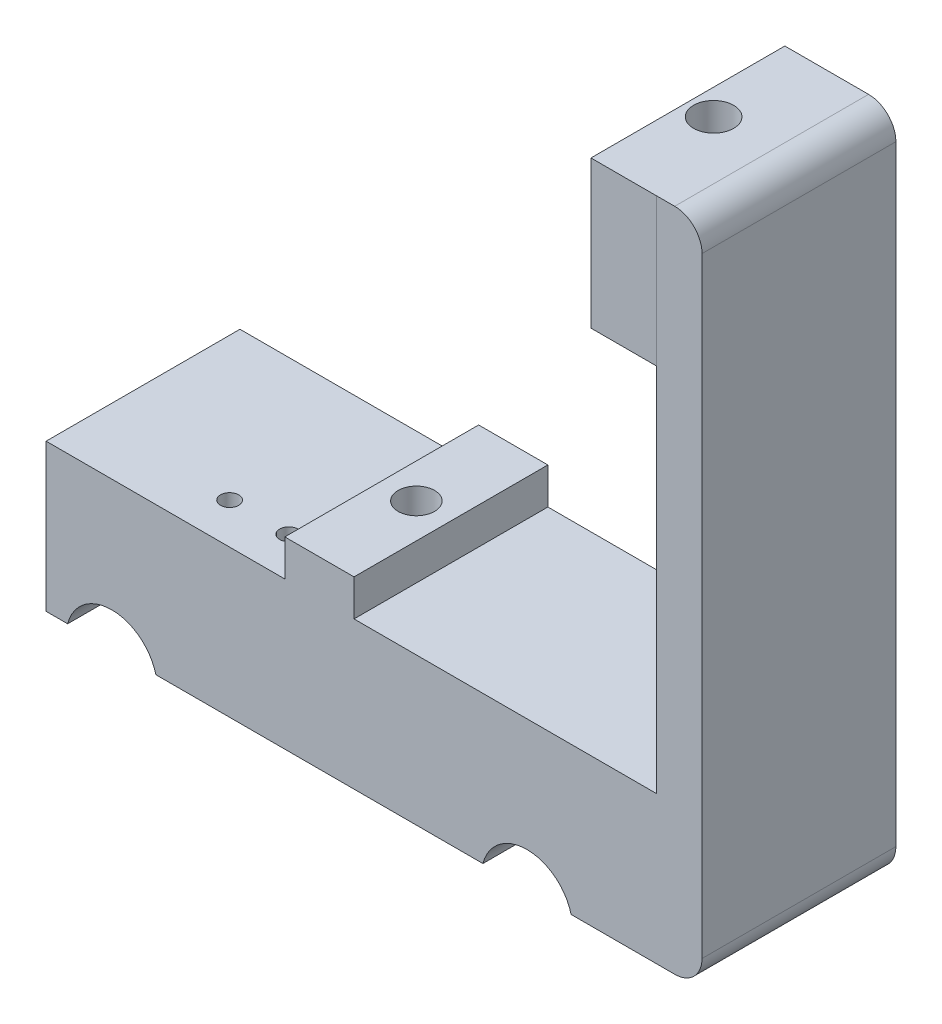
from build123d import *

# Parameters (mm, degrees)
BOSS_EXTRUDE1_DEPTH     = 10.8
BOSS_EXTRUDE2_DEPTH     = 10.64
CUT_EXTRUDE1_DEPTH      = 39.168054705
CUT_EXTRUDE1_DEPTH_BACK = 39.168054705
SKETCH5_R               = 5
FILLET1_R               = 1
SKETCH6_W               = 21.28
SKETCH6_H               = 16.18
BOSS_EXTRUDE3_DEPTH     = 12
SKETCH7_W               = 5
SKETCH7_H               = 21.281328743
BOSS_EXTRUDE4_DEPTH     = 56.83
SKETCH8_W               = 21.284331222
SKETCH8_H               = 16.18
BOSS_EXTRUDE5_DEPTH     = 7.19
FILLET3_R               = 3
SKETCH9_R               = 2.2
CUT_EXTRUDE2_DEPTH      = 85.918196519
SKETCH10_R              = 2
CUT_EXTRUDE3_DEPTH      = 85.918196519
SKETCH11_W              = 24.977296572
SKETCH11_H              = 9.721484234
CUT_EXTRUDE4_DEPTH      = 71.220021919
CUT_EXTRUDE5_REACH      = 86.898


with BuildPart() as part:
    # Sketch2 → Boss-Extrude1 (new body)
    with BuildSketch(Plane.XY):
        Polygon((-10.1, 0), (0, 0), (0, 7), (-6.25480432, 7), (-10.1, 1.709943763), align=None)
        Polygon((0, 0), (10.1, 0), (10.1, 1.709943763), (6.25480432, 7), (0, 7), align=None)
    extrude(amount=BOSS_EXTRUDE1_DEPTH)

    # Sketch4 → Boss-Extrude2 (add, symmetric)
    with BuildSketch(Plane.XY):
        Polygon((-3.8, 0), (-3.8, -4.8), (-30, -4.8), (-30, -20.98), (30, -20.98), (30, -4.8), (3.8, -4.8), (3.8, 0), align=None)
    extrude(amount=BOSS_EXTRUDE2_DEPTH, both=True)

    # Sketch5 → Cut-Extrude1 (cut, two sides: drawn at the far end of the back side and taken through both)
    with BuildSketch(Plane.XY.offset(-CUT_EXTRUDE1_DEPTH_BACK)):
        with Locations((-22.790976064, -22.227391232)):
            Circle(SKETCH5_R)
        with Locations((22.790976064, -22.227391232)):
            Circle(SKETCH5_R)
    extrude(amount=CUT_EXTRUDE1_DEPTH + CUT_EXTRUDE1_DEPTH_BACK, mode=Mode.SUBTRACT)

    # Fillet1
    fillet1_edges = [part.edges().sort_by_distance(p)[0] for p in [
        (-10.1, 0, 5.4),
        (-10.1, 1.709943763, 5.4),
        (-6.25480432, 7, 5.4),
        (6.25480432, 7, 5.4),
        (10.1, 1.709943763, 5.4),
        (10.1, 0, 5.4),
    ]]
    fillet(fillet1_edges, radius=FILLET1_R)

    # Sketch6 → Boss-Extrude3 (add)
    with BuildSketch(Plane(origin=(30, 0, 0), x_dir=(0, 0, -1), z_dir=(1, 0, 0))):
        with Locations((0, -12.89)):
            Rectangle(SKETCH6_W, SKETCH6_H)
    extrude(amount=BOSS_EXTRUDE3_DEPTH)

    # Sketch7 → Boss-Extrude4 (add)
    with BuildSketch(Plane(origin=(0, -4.8, 0), x_dir=(1, 0, 0), z_dir=(0, 1, 0))):
        with Locations((39.5, 0.000664372)):
            Rectangle(SKETCH7_W, SKETCH7_H)
    extrude(amount=BOSS_EXTRUDE4_DEPTH)

    # Sketch8 → Boss-Extrude5 (add)
    with BuildSketch(Plane.ZY.offset(-37)):
        with Locations((0.000836868, 43.94)):
            Rectangle(SKETCH8_W, SKETCH8_H)
    extrude(amount=BOSS_EXTRUDE5_DEPTH)

    # Fillet3
    fillet3_edges = [part.edges().sort_by_distance(p)[0] for p in [
        (42, -20.98, 0),
        (42, 52.03, -0.000664372),
    ]]
    fillet(fillet3_edges, radius=FILLET3_R)

    # Sketch9 → Cut-Extrude2 (cut, through all)
    with BuildSketch(Plane.XZ.offset(20.98)):
        with Locations((32.632878078, 0)):
            Circle(SKETCH9_R)
    extrude(amount=-CUT_EXTRUDE2_DEPTH, mode=Mode.SUBTRACT)

    # Sketch10 → Cut-Extrude3 (cut, through all)
    with BuildSketch(Plane.XZ.offset(20.98)):
        with Locations((0.000925951, 0)):
            Circle(SKETCH10_R)
    extrude(amount=-CUT_EXTRUDE3_DEPTH, mode=Mode.SUBTRACT)

    # Sketch11 → Cut-Extrude4 (cut, through all)
    with BuildSketch(Plane.XY.offset(10.8)):
        with Locations((-0.121132817, 4.060742117)):
            Rectangle(SKETCH11_W, SKETCH11_H)
    extrude(amount=-CUT_EXTRUDE4_DEPTH, mode=Mode.SUBTRACT)

    # Sketch13 → Cut-Extrude5 (cut, up to next)
    with BuildSketch(Plane.XZ.offset(20.98), mode=Mode.PRIVATE) as cut_extrude5_sk1:
        with BuildLine():
            ThreePointArc((-8.827441341, 6.170359992), (-7.827441341, 5.170359992), (-6.827441341, 6.170359992))
            ThreePointArc((-6.827441341, 6.170359992), (-7.827441341, 7.170359992), (-8.827441341, 6.170359992))
        make_face()
    cut_extrude5_tool1 = extrude(cut_extrude5_sk1.sketch, amount=-CUT_EXTRUDE5_REACH, mode=Mode.PRIVATE) & part.part
    # Sketch13 → Cut-Extrude5 (cut, up to next)
    with BuildSketch(Plane.XZ.offset(20.98), mode=Mode.PRIVATE) as cut_extrude5_sk2:
        with BuildLine():
            ThreePointArc((-13.327441341, 6.170359992), (-14.327441341, 7.170359992), (-15.327441341, 6.170359992))
            ThreePointArc((-15.327441341, 6.170359992), (-14.327441341, 5.170359992), (-13.327441341, 6.170359992))
        make_face()
    cut_extrude5_tool2 = extrude(cut_extrude5_sk2.sketch, amount=-CUT_EXTRUDE5_REACH, mode=Mode.PRIVATE) & part.part
    add(cut_extrude5_tool1.solids().sort_by_distance((-7.827441, -20.98, 6.17036))[0], mode=Mode.SUBTRACT)
    add(cut_extrude5_tool2.solids().sort_by_distance((-14.327441, -20.98, 6.17036))[0], mode=Mode.SUBTRACT)


solid = part.part
